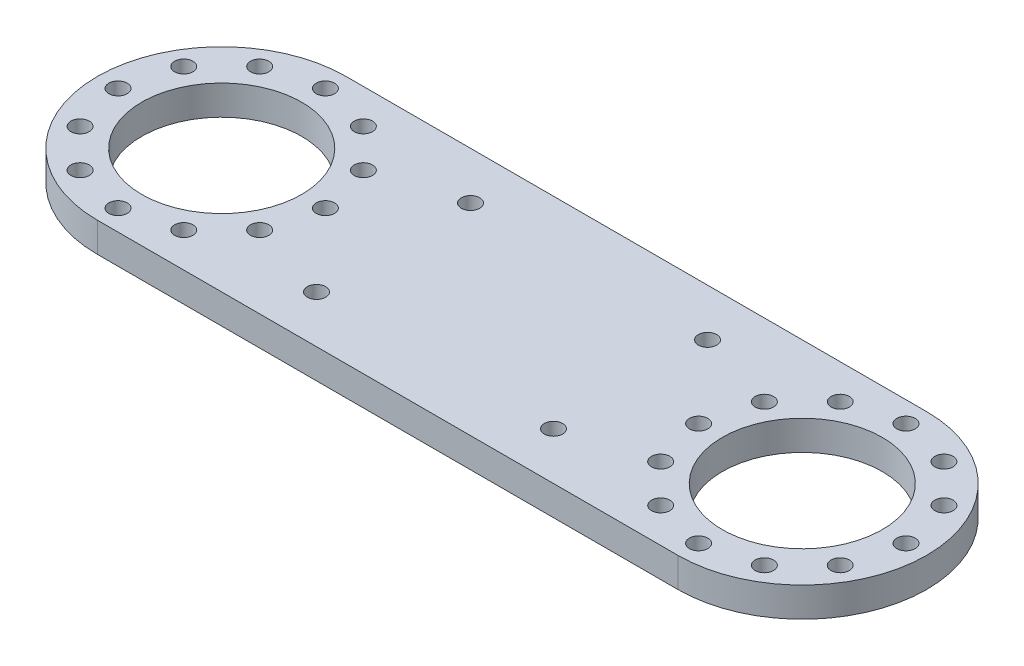
from build123d import *

# Parameters (mm, degrees)
SKETCH_1_R      = 13.5
SKETCH_1_R_2    = 1.55
EXTRUDE_1_DEPTH = 5


with BuildPart() as part:
    # 草图1 → 凸台-拉伸1 (new body)
    with BuildSketch(Plane(origin=(0, 0, 0), x_dir=(1, 0, 0), z_dir=(0, 1, 0))):
        with BuildLine():
            Line((-49, 21), (49, 21))
            ThreePointArc((49, 21), (70, 0), (49, -21))
            Line((49, -21), (-49, -21))
            ThreePointArc((-49, -21), (-70, 0), (-49, 21))
        make_face()
        with Locations(Location((-49, 0, 0), (0, 0, 270))):
            Circle(SKETCH_1_R, mode=Mode.SUBTRACT)
        with Locations(Location((-49, 17.5, 0), (0, 0, 270))):
            Circle(SKETCH_1_R_2, mode=Mode.SUBTRACT)
        with Locations(Location((-20, 13, 0), (0, 0, 270))):
            Circle(SKETCH_1_R_2, mode=Mode.SUBTRACT)
        with Locations(Location((-20, -13, 0), (0, 0, 270))):
            Circle(SKETCH_1_R_2, mode=Mode.SUBTRACT)
        with Locations(Location((-40.25, 15.155444566, 0), (0, 0, 270))):
            Circle(SKETCH_1_R_2, mode=Mode.SUBTRACT)
        with Locations(Location((-33.844555434, 8.75, 0), (0, 0, 270))):
            Circle(SKETCH_1_R_2, mode=Mode.SUBTRACT)
        with Locations(Location((-31.5, 0, 0), (0, 0, 270))):
            Circle(SKETCH_1_R_2, mode=Mode.SUBTRACT)
        with Locations(Location((-33.844555434, -8.75, 0), (0, 0, 270))):
            Circle(SKETCH_1_R_2, mode=Mode.SUBTRACT)
        with Locations(Location((-40.25, -15.155444566, 0), (0, 0, 270))):
            Circle(SKETCH_1_R_2, mode=Mode.SUBTRACT)
        with Locations(Location((-49, -17.5, 0), (0, 0, 270))):
            Circle(SKETCH_1_R_2, mode=Mode.SUBTRACT)
        with Locations(Location((-57.75, -15.155444566, 0), (0, 0, 270))):
            Circle(SKETCH_1_R_2, mode=Mode.SUBTRACT)
        with Locations(Location((-64.155444566, -8.75, 0), (0, 0, 270))):
            Circle(SKETCH_1_R_2, mode=Mode.SUBTRACT)
        with Locations(Location((-66.5, 0, 0), (0, 0, 270))):
            Circle(SKETCH_1_R_2, mode=Mode.SUBTRACT)
        with Locations(Location((-64.155444566, 8.75, 0), (0, 0, 270))):
            Circle(SKETCH_1_R_2, mode=Mode.SUBTRACT)
        with Locations(Location((-57.75, 15.155444566, 0), (0, 0, 270))):
            Circle(SKETCH_1_R_2, mode=Mode.SUBTRACT)
        with Locations(Location((57.75, 15.155444566, 0), (0, 0, 90))):
            Circle(SKETCH_1_R_2, mode=Mode.SUBTRACT)
        with Locations(Location((64.155444566, 8.75, 0), (0, 0, 90))):
            Circle(SKETCH_1_R_2, mode=Mode.SUBTRACT)
        with Locations(Location((66.5, 0, 0), (0, 0, 90))):
            Circle(SKETCH_1_R_2, mode=Mode.SUBTRACT)
        with Locations(Location((64.155444566, -8.75, 0), (0, 0, 90))):
            Circle(SKETCH_1_R_2, mode=Mode.SUBTRACT)
        with Locations(Location((57.75, -15.155444566, 0), (0, 0, 90))):
            Circle(SKETCH_1_R_2, mode=Mode.SUBTRACT)
        with Locations(Location((49, -17.5, 0), (0, 0, 90))):
            Circle(SKETCH_1_R_2, mode=Mode.SUBTRACT)
        with Locations(Location((40.25, -15.155444566, 0), (0, 0, 90))):
            Circle(SKETCH_1_R_2, mode=Mode.SUBTRACT)
        with Locations(Location((33.844555434, -8.75, 0), (0, 0, 90))):
            Circle(SKETCH_1_R_2, mode=Mode.SUBTRACT)
        with Locations(Location((31.5, 0, 0), (0, 0, 90))):
            Circle(SKETCH_1_R_2, mode=Mode.SUBTRACT)
        with Locations(Location((40.25, 15.155444566, 0), (0, 0, 90))):
            Circle(SKETCH_1_R_2, mode=Mode.SUBTRACT)
        with Locations(Location((20, -13, 0), (0, 0, 90))):
            Circle(SKETCH_1_R_2, mode=Mode.SUBTRACT)
        with Locations(Location((20, 13, 0), (0, 0, 90))):
            Circle(SKETCH_1_R_2, mode=Mode.SUBTRACT)
        with Locations(Location((49, 17.5, 0), (0, 0, 90))):
            Circle(SKETCH_1_R_2, mode=Mode.SUBTRACT)
        with Locations(Location((49, 0, 0), (0, 0, 90))):
            Circle(SKETCH_1_R, mode=Mode.SUBTRACT)
        with Locations(Location((33.844555434, 8.75, 0), (0, 0, 90))):
            Circle(SKETCH_1_R_2, mode=Mode.SUBTRACT)
    extrude(amount=EXTRUDE_1_DEPTH)


solid = part.part
